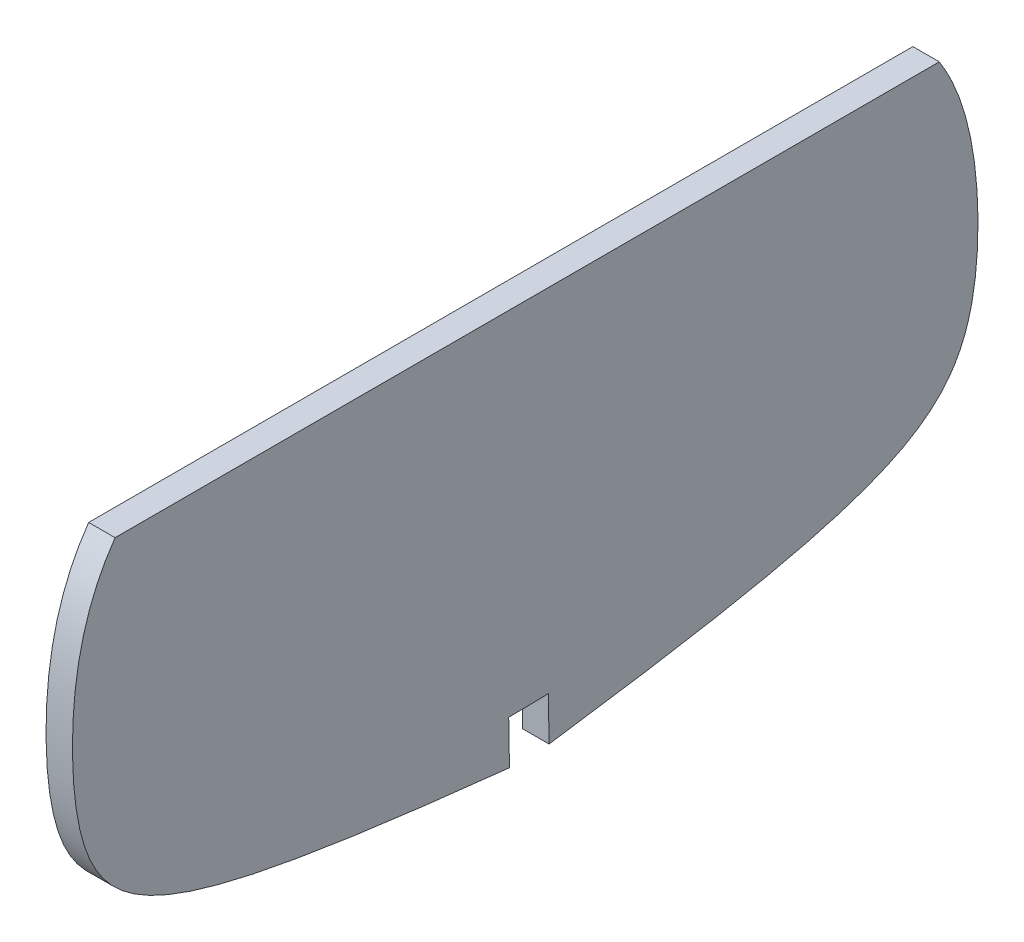
from build123d import *

# Parameters (mm, degrees)
BOSS_EXTRU_3_DEPTH      = 6
ENL_V_MAT_EXTRU_1_DEPTH = 6
ESQUISSE4_W             = 218.43509427
ESQUISSE4_H             = 33.522217437
ENL_V_MAT_EXTRU_2_DEPTH = 6


with BuildPart() as part:
    # Esquisse2 → Boss.-Extru.3 (new body)
    with BuildSketch(Plane(origin=(0, 0, 0), x_dir=(0, 0, -1), z_dir=(1, 0, 0))):
        with BuildLine():
            add(Edge.make_bspline(
                [(-7.065100079, 409.751237327), (-183.045107551, 403.249389946), (-48.294946403, 311.918725168), (-176.058062158, 306.927978459), (-4.983099793, 289.002460423)],
                knots=[0, 0, 0, 0, 0, 1, 1, 1, 1, 1], degree=4))
            add(Edge.make_bspline(
                [(-7.065100079, 409.751237327), (169.034448932, 409.320091083), (37.512972649, 313.398260751), (165.372196707, 312.815060008), (-4.983099793, 289.002460423)],
                knots=[0, 0, 0, 0, 0, 1, 1, 1, 1, 1], degree=4))
        make_face()
    extrude(amount=BOSS_EXTRU_3_DEPTH)

    # Esquisse3 → Enlèv. mat.-Extru.1 (cut)
    with BuildSketch(Plane(origin=(6, 0, 0), x_dir=(0, 0, -1), z_dir=(1, 0, 0))):
        Polygon((-9.492671401, 289.479989494), (-9.665095531, 299.479989494), (-0.665095531, 299.635171212), (-0.492671401, 289.635171212), (1.759983212, 274.106938881), (-11.796326648, 270.185646644), align=None)
    extrude(amount=-ENL_V_MAT_EXTRU_1_DEPTH, mode=Mode.SUBTRACT)

    # Esquisse4 → Enlèv. mat.-Extru.2 (cut)
    with BuildSketch(Plane(origin=(6, 0, 0), x_dir=(0, 0, -1), z_dir=(1, 0, 0))):
        with Locations((0.96996454, 396.283979233)):
            Rectangle(ESQUISSE4_W, ESQUISSE4_H)
    extrude(amount=-ENL_V_MAT_EXTRU_2_DEPTH, mode=Mode.SUBTRACT)


solid = part.part
